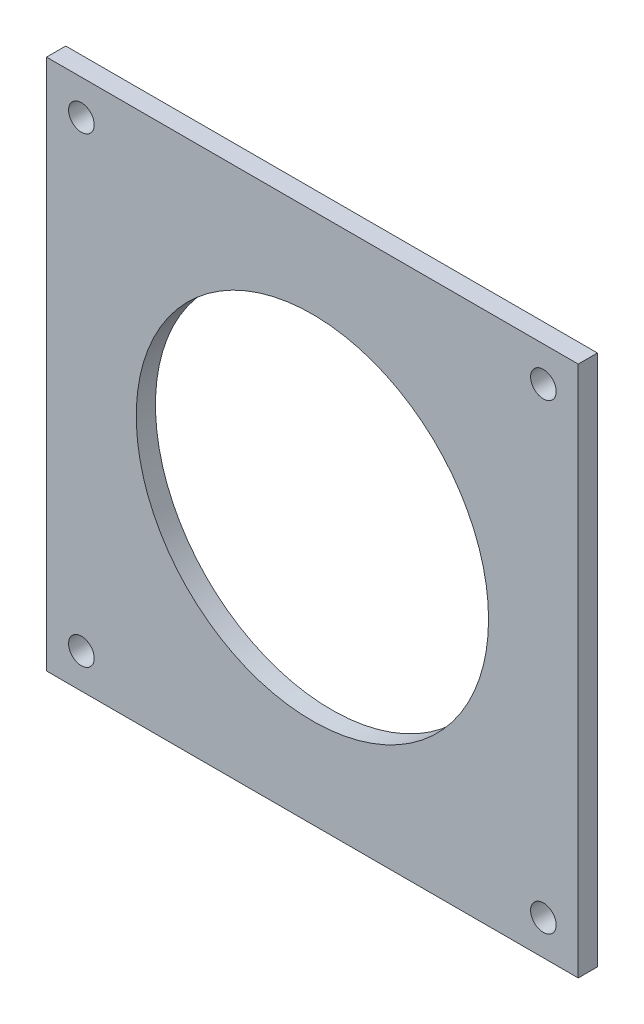
from build123d import *

# Parameters (mm, degrees)
SKETCH1_W           = 83
SKETCH1_H           = 83
SKETCH1_R           = 2
SKETCH1_R_2         = 27.5
BOSS_EXTRUDE1_DEPTH = 3


with BuildPart() as part:
    # Sketch1 → Boss-Extrude1 (new body)
    with BuildSketch(Plane(origin=(0, 0, 0), x_dir=(0, 1, 0), z_dir=(0, 0, 1))):
        Rectangle(SKETCH1_W, SKETCH1_H)
        with Locations(Location((36.062445841, -36.062445841, 0), (0, 0, 270))):
            Circle(SKETCH1_R, mode=Mode.SUBTRACT)
        with Locations(Location((-36.062445841, -36.062445841, 0), (0, 0, 270))):
            Circle(SKETCH1_R, mode=Mode.SUBTRACT)
        with Locations(Location((0, 0, 0), (0, 0, 270))):
            Circle(SKETCH1_R_2, mode=Mode.SUBTRACT)
        with Locations(Location((36.062445841, 36.062445841, 0), (0, 0, 270))):
            Circle(SKETCH1_R, mode=Mode.SUBTRACT)
        with Locations(Location((-36.062445841, 36.062445841, 0), (0, 0, 270))):
            Circle(SKETCH1_R, mode=Mode.SUBTRACT)
    extrude(amount=BOSS_EXTRUDE1_DEPTH)


solid = part.part
